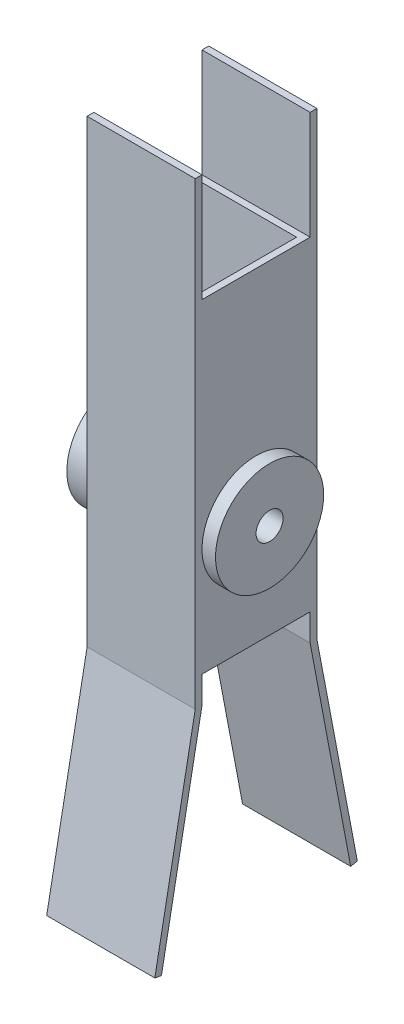
from build123d import *

# Parameters (mm, degrees)
BOSS_EXTRUDE1_DEPTH      = 25.4
SKETCH2_W                = 22.225
SKETCH2_H                = 22.225
CUT_EXTRUDE1_DEPTH       = 138.235224905
BOSS_EXTRUDE2_DEPTH      = 3.175
BOSS_EXTRUDE2_DEPTH_BACK = 31.75
SKETCH3_R                = 12.7
SKETCH4_R                = 3.175
CUT_EXTRUDE3_DEPTH       = 104.653950262


with BuildPart() as part:
    # Sketch1 → Boss-Extrude1 (new body)
    with BuildSketch(Plane(origin=(0, 0, 0), x_dir=(0, 0, -1), z_dir=(1, 0, 0))):
        Polygon((23.784673135, -94.354345527), (14.2875, -44.45), (14.2875, 63.5), (12.7, 63.5), (12.7, 38.1), (-12.7, 38.1), (-12.7, 63.5), (-14.2875, 63.5), (-14.2875, -44.45), (-23.784673135, -94.354345527), (-22.225, -94.650277885), (-12.7, -44.45), (-12.7, -38.1), (12.7, -38.1), (12.7, -44.45), (22.225, -94.650277885), align=None)
    extrude(amount=BOSS_EXTRUDE1_DEPTH)

    # Sketch2 → Cut-Extrude1 (cut, through all)
    with BuildSketch(Plane(origin=(0, 38.1, 0), x_dir=(1, 0, 0), z_dir=(0, 1, 0))):
        with Locations((12.7, 0)):
            Rectangle(SKETCH2_W, SKETCH2_H)
    extrude(amount=-CUT_EXTRUDE1_DEPTH, mode=Mode.SUBTRACT)

    # Sketch3 → Boss-Extrude2 (add, two sides: drawn at the far end of the back side and taken through both)
    with BuildSketch(Plane(origin=(25.4, 0, 0), x_dir=(0, 0, -1), z_dir=(1, 0, 0)).offset(-BOSS_EXTRUDE2_DEPTH_BACK)):
        with Locations((0, -12.7)):
            Circle(SKETCH3_R)
    extrude(amount=BOSS_EXTRUDE2_DEPTH + BOSS_EXTRUDE2_DEPTH_BACK)

    # Sketch4 → Cut-Extrude3 (cut, through all)
    with BuildSketch(Plane(origin=(28.575, 0, 0), x_dir=(0, 0, -1), z_dir=(1, 0, 0))):
        with Locations((0, -12.7)):
            Circle(SKETCH4_R)
    extrude(amount=-CUT_EXTRUDE3_DEPTH, mode=Mode.SUBTRACT)


solid = part.part
